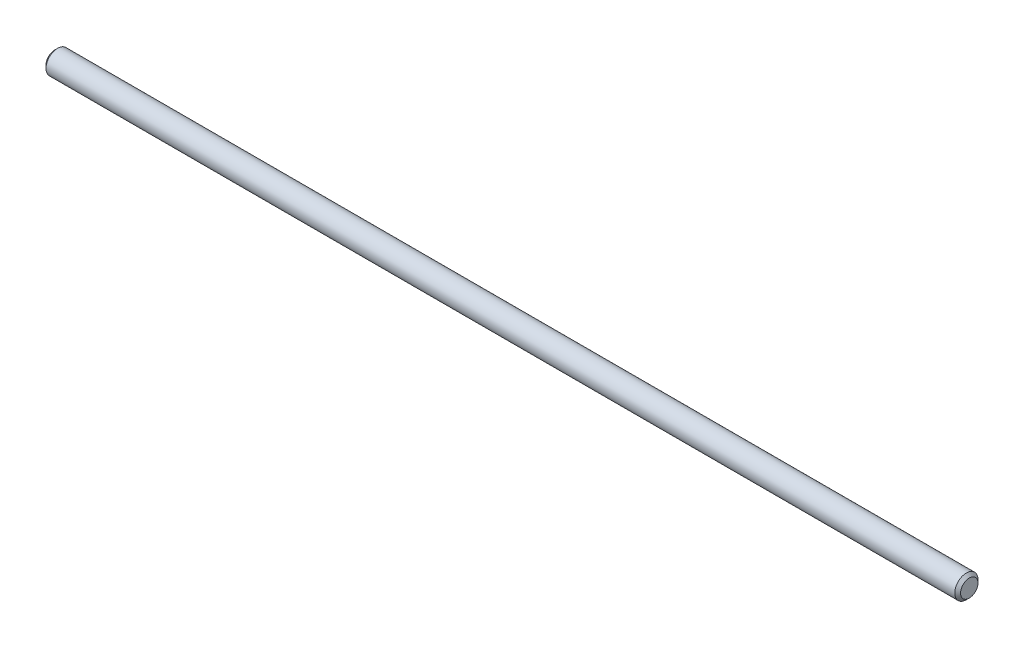
from build123d import *

# Parameters (mm, degrees)
SKETCH_1_R      = 4
EXTRUDE_1_DEPTH = 315
CHAMFER_1_SIZE  = 1


with BuildPart() as part:
    # Эскиз1 → Бобышка-Вытянуть1 (new body)
    with BuildSketch(Plane(origin=(0, 0, 0), x_dir=(0, 0, -1), z_dir=(1, 0, 0))):
        Circle(SKETCH_1_R)
    extrude(amount=EXTRUDE_1_DEPTH)

    # Фаска1
    chamfer_1_edges = [part.edges().sort_by_distance(p)[0] for p in [
        (0, 0, 4),
        (315, 0, 4),
    ]]
    chamfer(chamfer_1_edges, length=CHAMFER_1_SIZE)


solid = part.part
